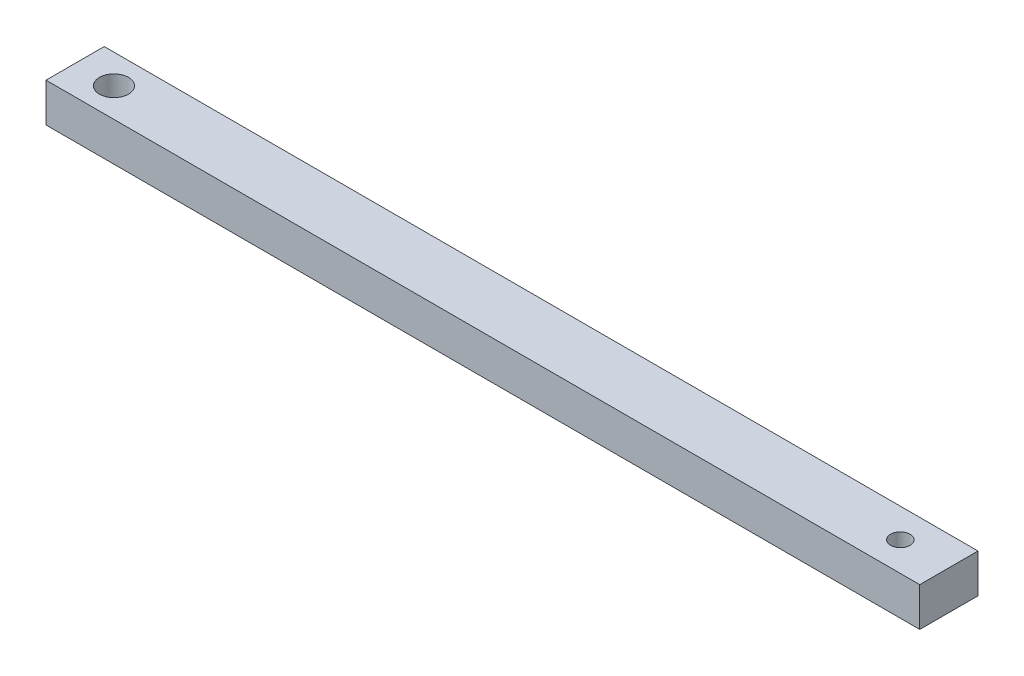
from build123d import *

# Parameters (mm, degrees)
SKETCH_1_W          = 450
SKETCH_1_H          = 20
EXTRUDE_1_DEPTH     = 30
SKETCH_2_R          = 7.5
CUT_EXTRUDE_1_DEPTH = 30
SKETCH_3_R          = 5
CUT_EXTRUDE_2_DEPTH = 228.870577302


with BuildPart() as part:
    # 草图1 → 凸台-拉伸1 (new body)
    with BuildSketch(Plane.XY):
        Rectangle(SKETCH_1_W, SKETCH_1_H)
    extrude(amount=EXTRUDE_1_DEPTH)

    # 草图2 → 切除-拉伸1 (cut)
    with BuildSketch(Plane(origin=(0, 10, 0), x_dir=(1, 0, 0), z_dir=(0, 1, 0))):
        with Locations(Location((-205, -15, 0), (0, 0, 270))):
            Circle(SKETCH_2_R)
    extrude(amount=-CUT_EXTRUDE_1_DEPTH, mode=Mode.SUBTRACT)

    # 草图3 → 切除-拉伸2 (cut, through all)
    with BuildSketch(Plane(origin=(0, 10, 0), x_dir=(1, 0, 0), z_dir=(0, 1, 0))):
        with Locations(Location((200, -15, 0), (0, 0, 270))):
            Circle(SKETCH_3_R)
    extrude(amount=-CUT_EXTRUDE_2_DEPTH, mode=Mode.SUBTRACT)


solid = part.part
